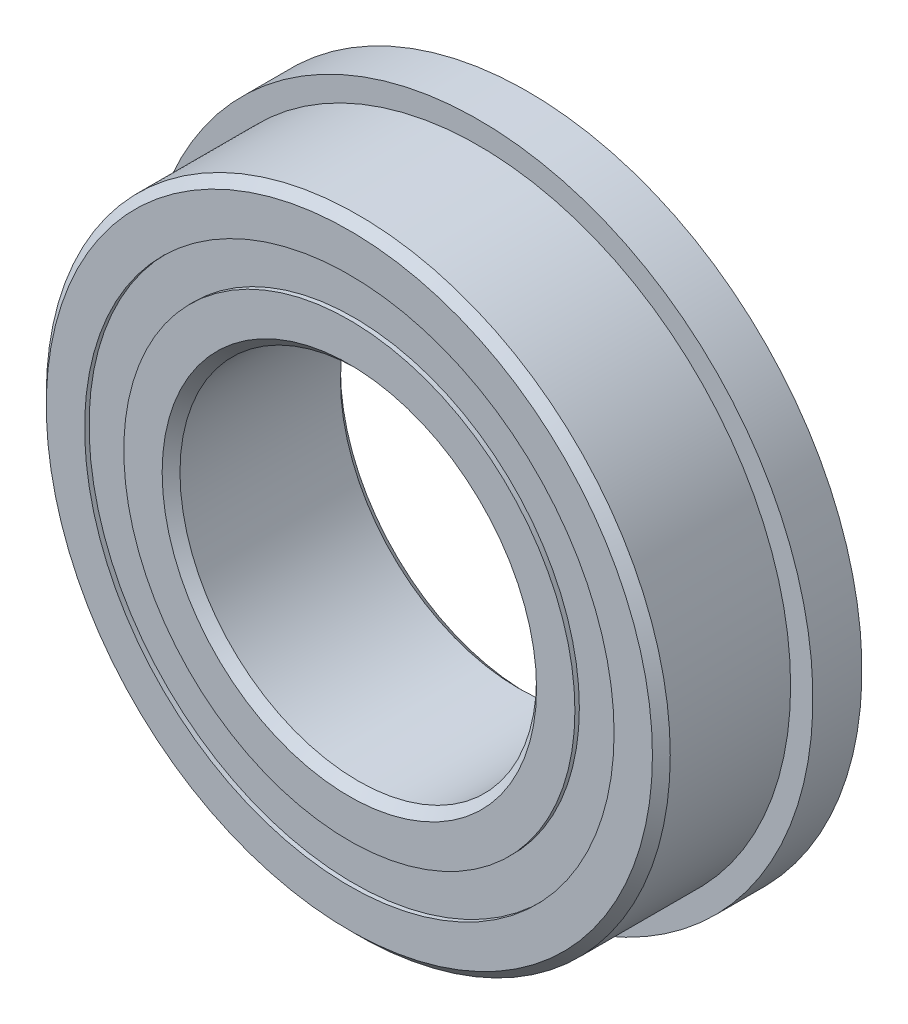
from build123d import *

# Parameters (mm, degrees)
CIRPATTERN1_COUNT = 12
SKETCH5_W         = 0.908366581
SKETCH5_H         = 0.87912088
SKETCH6_W         = 1.1
SKETCH6_H         = 1.56043956


with BuildPart() as part:
    # Sketch1 → Revolve1 (revolve)
    with BuildSketch(Plane(origin=(0, 0, 0), x_dir=(0, 0, -1), z_dir=(1, 0, 0))):
        with BuildLine():
            Line((1.8, 7), (-1.8, 7))
            Line((-1.8, 7), (-2, 6.8))
            Line((-2, 6.8), (-2, 5.93956044))
            Line((-2, 5.93956044), (-0.888888889, 5.93956044))
            ThreePointArc((-0.888888889, 5.93956044), (0, 6.491633419), (0.888888889, 5.93956044))
            Line((0.888888889, 5.93956044), (2, 5.93956044))
            Line((2, 5.93956044), (2, 6.8))
            Line((2, 6.8), (1.8, 7))
        make_face()
    revolve(axis=Axis((0, 0, 2), (0, 0, -1)))

    # Sketch6 → Revolve6 (revolve)
    with BuildSketch(Plane(origin=(0, 0, 0), x_dir=(0, 0, -1), z_dir=(1, 0, 0))):
        with Locations((1.45, 6.71978022)):
            Rectangle(SKETCH6_W, SKETCH6_H)
    revolve(axis=Axis((0, 0, -2), (0, 0, 1)))


with BuildPart() as body_2:
    # Sketch3 → Revolve3 (revolve)
    with BuildSketch(Plane(origin=(0, 0, 0), x_dir=(0, 0, -1), z_dir=(1, 0, 0))):
        with BuildLine():
            Line((-2, 5.06043956), (-0.888888889, 5.06043956))
            ThreePointArc((-0.888888889, 5.06043956), (0, 4.508366581), (0.888888889, 5.06043956))
            Line((0.888888889, 5.06043956), (2, 5.06043956))
            Line((2, 5.06043956), (2, 4.2))
            Line((2, 4.2), (1.8, 4))
            Line((1.8, 4), (-1.8, 4))
            Line((-1.8, 4), (-2, 4.2))
            Line((-2, 4.2), (-2, 5.06043956))
        make_face()
    revolve(axis=Axis((0, 0, 2), (0, 0, -1)))


with BuildPart() as body_3:
    # Sketch4 → Revolve4 (revolve)
    with BuildSketch(Plane(origin=(0, 0, 0), x_dir=(0, 0, -1), z_dir=(1, 0, 0))):
        with BuildLine():
            Line((-0.991633419, 5.5), (0.991633419, 5.5))
            ThreePointArc((0.991633419, 5.5), (0, 6.491633419), (-0.991633419, 5.5))
        make_face()
    revolve(axis=Axis((0, 5.5, 0.991633419), (0, 0, -1)))


with BuildPart() as cirpattern1_1:
    # CirPattern1: pattern copy
    add(body_3.part.rotate(Axis((0, 0, -2), (0, 0, 1)), 1 * 360 / CIRPATTERN1_COUNT))


with BuildPart() as cirpattern1_2:
    # CirPattern1: pattern copy
    add(body_3.part.rotate(Axis((0, 0, -2), (0, 0, 1)), 2 * 360 / CIRPATTERN1_COUNT))


with BuildPart() as cirpattern1_3:
    # CirPattern1: pattern copy
    add(body_3.part.rotate(Axis((0, 0, -2), (0, 0, 1)), 3 * 360 / CIRPATTERN1_COUNT))


with BuildPart() as cirpattern1_4:
    # CirPattern1: pattern copy
    add(body_3.part.rotate(Axis((0, 0, -2), (0, 0, 1)), 4 * 360 / CIRPATTERN1_COUNT))


with BuildPart() as cirpattern1_5:
    # CirPattern1: pattern copy
    add(body_3.part.rotate(Axis((0, 0, -2), (0, 0, 1)), 5 * 360 / CIRPATTERN1_COUNT))


with BuildPart() as cirpattern1_6:
    # CirPattern1: pattern copy
    add(body_3.part.rotate(Axis((0, 0, -2), (0, 0, 1)), 6 * 360 / CIRPATTERN1_COUNT))


with BuildPart() as cirpattern1_7:
    # CirPattern1: pattern copy
    add(body_3.part.rotate(Axis((0, 0, -2), (0, 0, 1)), 7 * 360 / CIRPATTERN1_COUNT))


with BuildPart() as cirpattern1_8:
    # CirPattern1: pattern copy
    add(body_3.part.rotate(Axis((0, 0, -2), (0, 0, 1)), 8 * 360 / CIRPATTERN1_COUNT))


with BuildPart() as cirpattern1_9:
    # CirPattern1: pattern copy
    add(body_3.part.rotate(Axis((0, 0, -2), (0, 0, 1)), 9 * 360 / CIRPATTERN1_COUNT))


with BuildPart() as cirpattern1_10:
    # CirPattern1: pattern copy
    add(body_3.part.rotate(Axis((0, 0, -2), (0, 0, 1)), 10 * 360 / CIRPATTERN1_COUNT))


with BuildPart() as cirpattern1_11:
    # CirPattern1: pattern copy
    add(body_3.part.rotate(Axis((0, 0, -2), (0, 0, 1)), 11 * 360 / CIRPATTERN1_COUNT))


with BuildPart() as body_15:
    # Sketch5 → Revolve5 (revolve)
    with BuildSketch(Plane(origin=(0, 0, 0), x_dir=(0, 0, -1), z_dir=(1, 0, 0))):
        with Locations((-1.44581671, 5.5)):
            Rectangle(SKETCH5_W, SKETCH5_H)
        with Locations((1.44581671, 5.5)):
            Rectangle(SKETCH5_W, SKETCH5_H)
    revolve(axis=Axis((0, 0, 2), (0, 0, -1)))


solid = Compound([part.part, body_2.part, body_3.part, cirpattern1_1.part, cirpattern1_2.part, cirpattern1_3.part, cirpattern1_4.part, cirpattern1_5.part, cirpattern1_6.part, cirpattern1_7.part, cirpattern1_8.part, cirpattern1_9.part, cirpattern1_10.part, cirpattern1_11.part, body_15.part])
